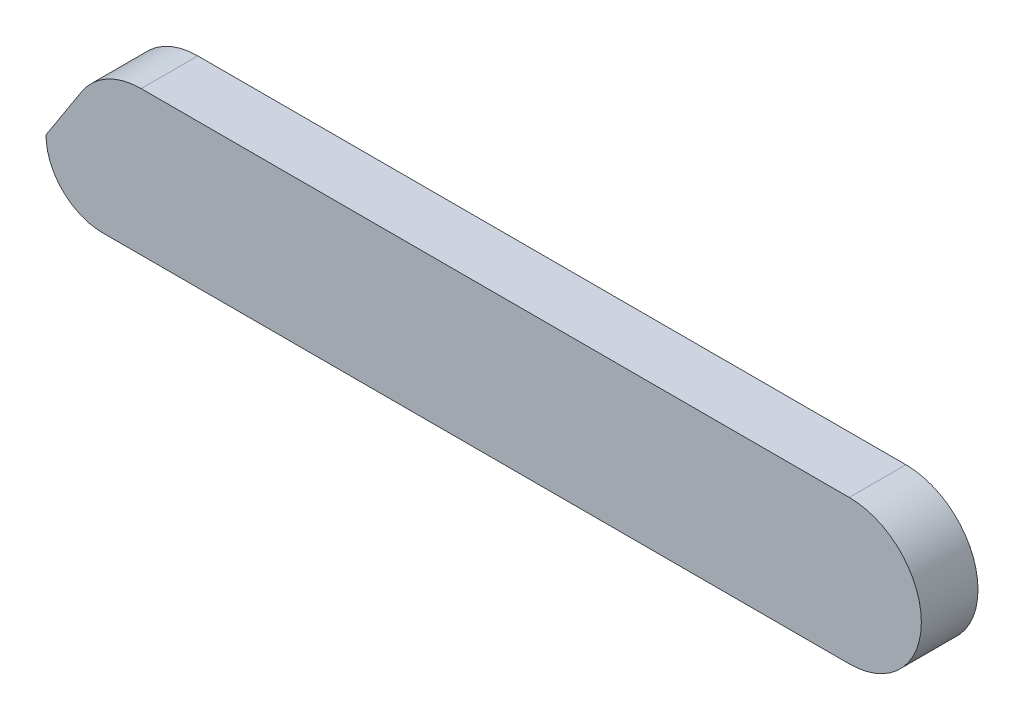
from build123d import *

# Parameters (mm, degrees)
BOSS_EXTRUDE1_DEPTH = 8
SKETCH4_R           = 2.55
CUT_EXTRUDE1_DEPTH  = 7


with BuildPart() as part:
    # Sketch2 → Boss-Extrude1 (new body)
    with BuildSketch(Plane.XY):
        with BuildLine():
            Line((-50.683757693, 15.376803881), (49.316242307, 15.376803881))
            ThreePointArc((49.316242307, 15.376803881), (59.496208487, 5.196837701), (49.316242307, -4.98312848))
            Line((49.316242307, -4.98312848), (-56.12878489, -4.98312848))
            ThreePointArc((-56.12878489, -4.98312848), (-61.779081531, -2.642698979), (-64.119511032, 3.007597662))
            Line((-64.119511032, 3.007597662), (-59.08344563, 10.803150955))
            ThreePointArc((-59.08344563, 10.803150955), (-55.465835132, 14.15927138), (-50.683757693, 15.376803881))
        make_face()
    extrude(amount=BOSS_EXTRUDE1_DEPTH)

    # Sketch4 → Cut-Extrude1 (cut)
    with BuildSketch(Plane.XZ.offset(4.98312848)):
        with Locations((-53.279822917, 4)):
            Circle(SKETCH4_R)
    extrude(amount=-CUT_EXTRUDE1_DEPTH, mode=Mode.SUBTRACT)


solid = part.part
